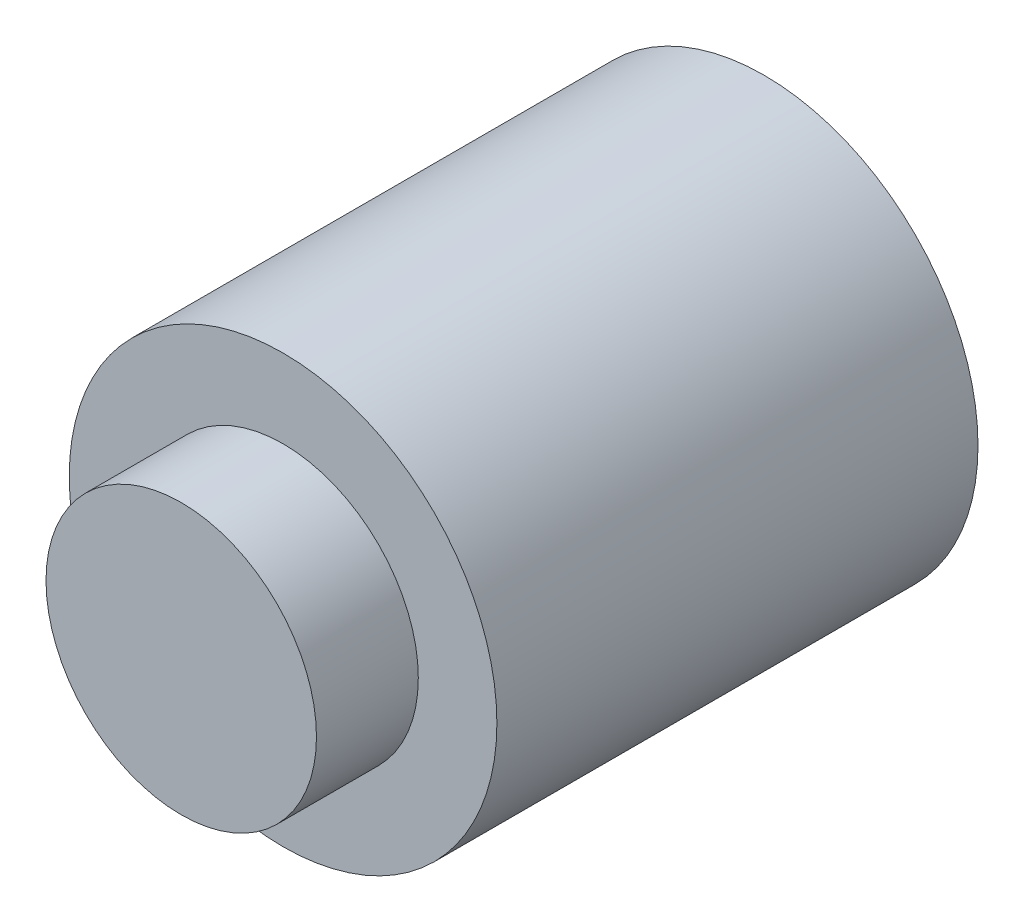
from build123d import *

# Parameters (mm, degrees)
F_4_40_TAPPED_HOLE1_D     = 2.2606
F_4_40_TAPPED_HOLE1_DEPTH = 9.525
F_4_40_TAPPED_HOLE1_TIP   = 0.679152758


with BuildPart() as part:
    # Sketch1 → Revolve1 (revolve)
    with BuildSketch(Plane(origin=(0, 0, 0), x_dir=(0, 0, -1), z_dir=(1, 0, 0))):
        Polygon((0, 0), (0, 12.6492), (9.525, 12.6492), (9.525, 20), (54.525, 20), (54.525, 13.886751346), (49.525, 11), (19.525, 11), (19.525, 0), align=None)
    revolve(axis=Axis((0, 0, -19.525), (0, 0, 1)))

    # #4-40 Tapped Hole1
    with Locations(Plane(origin=(0, 0, -54.525), x_dir=(-1, 0, 0), z_dir=(0, 0, -1))):
        with Locations((16.8275, 0), (0.223849371, 16.826011046), (0, -16.8275), (-16.8275, 0)):
            Hole(F_4_40_TAPPED_HOLE1_D / 2, depth=F_4_40_TAPPED_HOLE1_DEPTH)
            with Locations((0, 0, -(F_4_40_TAPPED_HOLE1_DEPTH + F_4_40_TAPPED_HOLE1_TIP / 2))):  # 118° drill point
                Cone(0, F_4_40_TAPPED_HOLE1_D / 2, F_4_40_TAPPED_HOLE1_TIP, mode=Mode.SUBTRACT)


solid = part.part
